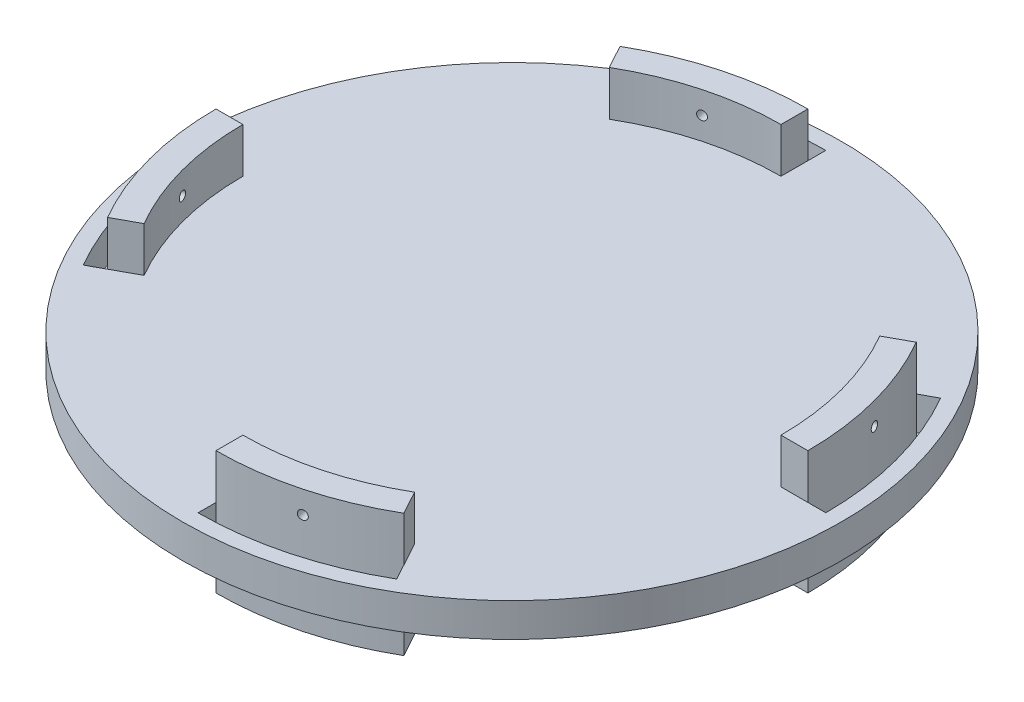
from build123d import *

# Parameters (mm, degrees)
BASE_DEPTH                     = 4.7625
BASE_DEPTH_BACK                = 4.7625
SKETCH1_R                      = 93.345
BOTTOM_SUPPORT_HOLES_DEPTH     = 4.7625
BOTTOM_START                   = 12.7
BOTTOM_SUPPORT_GUIDE_DEPTH     = 12.7
SKETCH6_R                      = 1.27
BOTTOM_BOLT_HOLE_DEPTH         = 12.7
BOTTOM_PATTERN_COUNT           = 4
BOTTOM_PATTERN_COPY_1_DEPTH    = 4.7625
BOTTOM_PATTERN_COPY_2_DEPTH    = 4.7625
BOTTOM_PATTERN_COPY_3_DEPTH    = 4.7625
BOTTOM_PATTERN_COPY_4_DEPTH    = 12.7
BOTTOM_PATTERN_COPY_5_DEPTH    = 12.7
BOTTOM_PATTERN_COPY_6_DEPTH    = 12.7
BOTTOM_PATTERN_COPY_7_SKETCH_R = 1.27
BOTTOM_PATTERN_COPY_7_DEPTH    = 12.7
BOTTOM_PATTERN_COPY_8_SKETCH_R = 1.27
BOTTOM_PATTERN_COPY_8_DEPTH    = 12.7
BOTTOM_PATTERN_COPY_9_SKETCH_R = 1.27
BOTTOM_PATTERN_COPY_9_DEPTH    = 12.7


with BuildPart() as part:
    # Sketch1 → Base (new, two sides: drawn at the far end of the back side and taken through both)
    with BuildSketch(Plane(origin=(0, 0, 0), x_dir=(1, 0, 0), z_dir=(0, 1, 0)).offset(-BASE_DEPTH_BACK)):
        Circle(SKETCH1_R)
    extrude(amount=BASE_DEPTH + BASE_DEPTH_BACK)

    # Sketch2 → Bottom support holes (cut)
    with BuildSketch(Plane(origin=(0, 4.7625, 0), x_dir=(1, 0, 0), z_dir=(0, 1, 0))):
        with BuildLine():
            Line((0, 88.9), (0, 83.82))
            ThreePointArc((0, 83.82), (-21.72026739, 80.956916842), (-41.956713931, 72.563258996))
            Line((-41.956713931, 72.563258996), (-44.39288973, 77.022602796))
            ThreePointArc((-44.39288973, 77.022602796), (-22.977169228, 85.879332172), (0, 88.9))
        make_face()
    bottom_support_holes = extrude(amount=-BOTTOM_SUPPORT_HOLES_DEPTH, mode=Mode.SUBTRACT)

    # Sketch3 → Bottom support guide (add)
    with BuildSketch(Plane(origin=(0, 4.7625, 0), x_dir=(1, 0, 0), z_dir=(0, 1, 0)).offset(BOTTOM_START)):
        with BuildLine():
            Line((0, 83.82), (0, 76.2))
            ThreePointArc((0, 76.2), (-19.834896001, 73.573207764), (-38.302281481, 65.8739344))
            Line((-38.302281481, 65.8739344), (-41.956713931, 72.563258996))
            ThreePointArc((-41.956713931, 72.563258996), (-21.72026739, 80.956916842), (0, 83.82))
        make_face()
    bottom_support_guide = extrude(amount=-BOTTOM_SUPPORT_GUIDE_DEPTH)

    # Sketch6 → Bottom bolt hole (cut, symmetric)
    with BuildSketch(Plane(origin=(-20.978356966, 0, -78.191629498), x_dir=(-0.9658424820058785, 0, 0.2591298901183038), z_dir=(-0.2591298901183038, 0, -0.9658424820058785))):
        with Locations((-0.00326739, 11.1125)):
            Circle(SKETCH6_R)
    bottom_bolt_hole = extrude(amount=BOTTOM_BOLT_HOLE_DEPTH, both=True, mode=Mode.SUBTRACT)

    # Support mirror: Bottom support holes, Bottom support guide, Bottom bolt hole across plane
    add(bottom_support_holes.mirror(Plane.ZX), mode=Mode.SUBTRACT)
    add(bottom_support_guide.mirror(Plane.ZX))
    add(bottom_bolt_hole.mirror(Plane.ZX), mode=Mode.SUBTRACT)

    # Bottom pattern: Bottom support holes, Bottom support guide, Bottom bolt hole ×4 about axis
    bottom_pattern_axis = Axis((0, 4.7625, 0), (0, 1, 0))
    add([bottom_support_holes.rotate(bottom_pattern_axis, i * 360 / BOTTOM_PATTERN_COUNT) for i in range(1, BOTTOM_PATTERN_COUNT)], mode=Mode.SUBTRACT)
    add([bottom_support_guide.rotate(bottom_pattern_axis, i * 360 / BOTTOM_PATTERN_COUNT) for i in range(1, BOTTOM_PATTERN_COUNT)])
    add([bottom_bolt_hole.rotate(bottom_pattern_axis, i * 360 / BOTTOM_PATTERN_COUNT) for i in range(1, BOTTOM_PATTERN_COUNT)], mode=Mode.SUBTRACT)

    # Bottom pattern copy 1 sketch → Bottom pattern copy 1 (cut)
    with BuildSketch(Plane(origin=(0, -4.7625, 0), x_dir=(0, 0, -1), z_dir=(0, -1, 0))):
        with BuildLine():
            Line((0, -88.9), (0, -83.82))
            ThreePointArc((0, -83.82), (-21.72026739, -80.956916842), (-41.956713931, -72.563258996))
            Line((-41.956713931, -72.563258996), (-44.39288973, -77.022602796))
            ThreePointArc((-44.39288973, -77.022602796), (-22.977169228, -85.879332172), (0, -88.9))
        make_face()
    extrude(amount=-BOTTOM_PATTERN_COPY_1_DEPTH, mode=Mode.SUBTRACT)

    # Bottom pattern copy 2 sketch → Bottom pattern copy 2 (cut)
    with BuildSketch(Plane(origin=(0, -4.7625, 0), x_dir=(-1, 0, 0), z_dir=(0, -1, 0))):
        with BuildLine():
            Line((0, -88.9), (0, -83.82))
            ThreePointArc((0, -83.82), (-21.72026739, -80.956916842), (-41.956713931, -72.563258996))
            Line((-41.956713931, -72.563258996), (-44.39288973, -77.022602796))
            ThreePointArc((-44.39288973, -77.022602796), (-22.977169228, -85.879332172), (0, -88.9))
        make_face()
    extrude(amount=-BOTTOM_PATTERN_COPY_2_DEPTH, mode=Mode.SUBTRACT)

    # Bottom pattern copy 3 sketch → Bottom pattern copy 3 (cut)
    with BuildSketch(Plane(origin=(0, -4.7625, 0), x_dir=(0, 0, 1), z_dir=(0, -1, 0))):
        with BuildLine():
            Line((0, -88.9), (0, -83.82))
            ThreePointArc((0, -83.82), (-21.72026739, -80.956916842), (-41.956713931, -72.563258996))
            Line((-41.956713931, -72.563258996), (-44.39288973, -77.022602796))
            ThreePointArc((-44.39288973, -77.022602796), (-22.977169228, -85.879332172), (0, -88.9))
        make_face()
    extrude(amount=-BOTTOM_PATTERN_COPY_3_DEPTH, mode=Mode.SUBTRACT)

    # Bottom pattern copy 4 sketch → Bottom pattern copy 4 (add)
    with BuildSketch(Plane(origin=(0, -4.7625, 0), x_dir=(0, 0, -1), z_dir=(0, -1, 0)).offset(BOTTOM_START)):
        with BuildLine():
            Line((0, -83.82), (0, -76.2))
            ThreePointArc((0, -76.2), (-19.834896001, -73.573207764), (-38.302281481, -65.8739344))
            Line((-38.302281481, -65.8739344), (-41.956713931, -72.563258996))
            ThreePointArc((-41.956713931, -72.563258996), (-21.72026739, -80.956916842), (0, -83.82))
        make_face()
    extrude(amount=-BOTTOM_PATTERN_COPY_4_DEPTH)

    # Bottom pattern copy 5 sketch → Bottom pattern copy 5 (add)
    with BuildSketch(Plane(origin=(0, -4.7625, 0), x_dir=(-1, 0, 0), z_dir=(0, -1, 0)).offset(BOTTOM_START)):
        with BuildLine():
            Line((0, -83.82), (0, -76.2))
            ThreePointArc((0, -76.2), (-19.834896001, -73.573207764), (-38.302281481, -65.8739344))
            Line((-38.302281481, -65.8739344), (-41.956713931, -72.563258996))
            ThreePointArc((-41.956713931, -72.563258996), (-21.72026739, -80.956916842), (0, -83.82))
        make_face()
    extrude(amount=-BOTTOM_PATTERN_COPY_5_DEPTH)

    # Bottom pattern copy 6 sketch → Bottom pattern copy 6 (add)
    with BuildSketch(Plane(origin=(0, -4.7625, 0), x_dir=(0, 0, 1), z_dir=(0, -1, 0)).offset(BOTTOM_START)):
        with BuildLine():
            Line((0, -83.82), (0, -76.2))
            ThreePointArc((0, -76.2), (-19.834896001, -73.573207764), (-38.302281481, -65.8739344))
            Line((-38.302281481, -65.8739344), (-41.956713931, -72.563258996))
            ThreePointArc((-41.956713931, -72.563258996), (-21.72026739, -80.956916842), (0, -83.82))
        make_face()
    extrude(amount=-BOTTOM_PATTERN_COPY_6_DEPTH)

    # Bottom pattern copy 7 sketch → Bottom pattern copy 7 (cut, symmetric)
    with BuildSketch(Plane(origin=(-78.191629498, 0, 20.978356966), x_dir=(0.25912989011830373, 0, 0.9658424820058785), z_dir=(-0.9658424820058785, 0, 0.25912989011830373))):
        with Locations((-0.00326739, -11.1125)):
            Circle(BOTTOM_PATTERN_COPY_7_SKETCH_R)
    extrude(amount=BOTTOM_PATTERN_COPY_7_DEPTH, both=True, mode=Mode.SUBTRACT)

    # Bottom pattern copy 8 sketch → Bottom pattern copy 8 (cut, symmetric)
    with BuildSketch(Plane(origin=(20.978356966, 0, 78.191629498), x_dir=(0.9658424820058785, 0, -0.2591298901183037), z_dir=(0.2591298901183037, 0, 0.9658424820058785))):
        with Locations((-0.00326739, -11.1125)):
            Circle(BOTTOM_PATTERN_COPY_8_SKETCH_R)
    extrude(amount=BOTTOM_PATTERN_COPY_8_DEPTH, both=True, mode=Mode.SUBTRACT)

    # Bottom pattern copy 9 sketch → Bottom pattern copy 9 (cut, symmetric)
    with BuildSketch(Plane(origin=(78.191629498, 0, -20.978356966), x_dir=(-0.2591298901183036, 0, -0.9658424820058785), z_dir=(0.9658424820058785, 0, -0.2591298901183036))):
        with Locations((-0.00326739, -11.1125)):
            Circle(BOTTOM_PATTERN_COPY_9_SKETCH_R)
    extrude(amount=BOTTOM_PATTERN_COPY_9_DEPTH, both=True, mode=Mode.SUBTRACT)


solid = part.part
